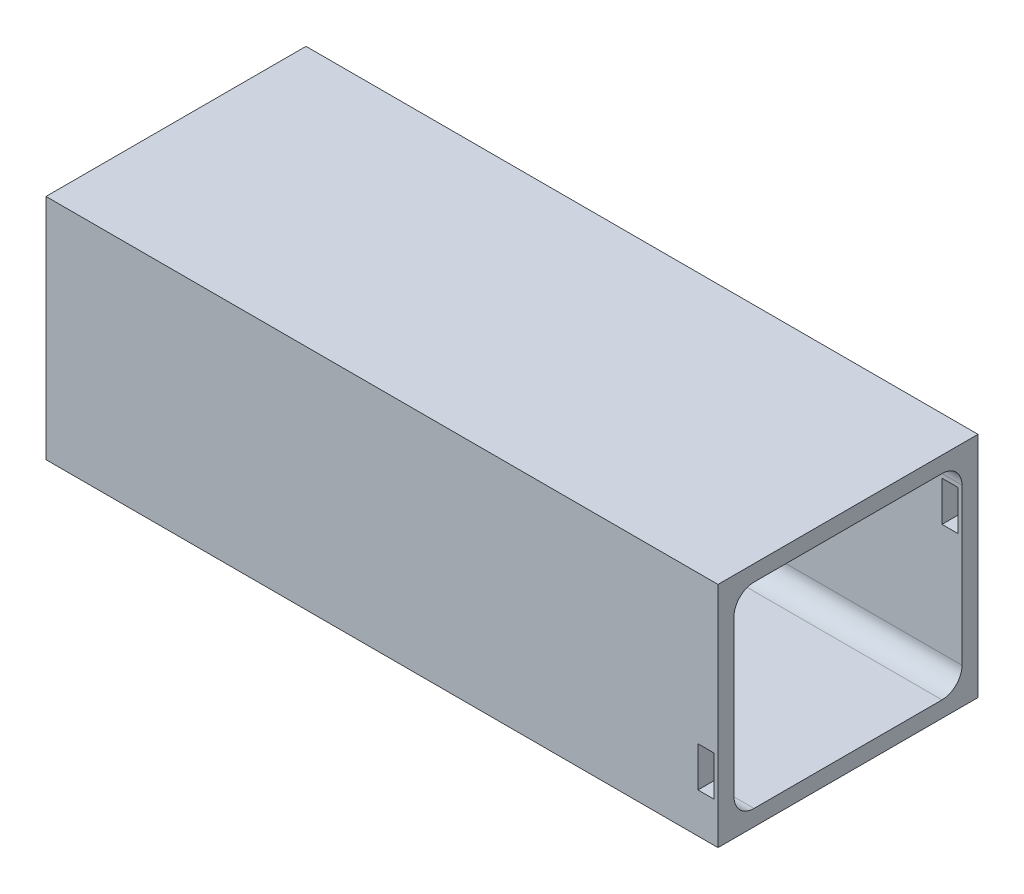
from build123d import *

# Parameters (mm, degrees)
SKETCH_1_W          = 65
SKETCH_1_H          = 57
EXTRUDE_1_DEPTH     = 167
SKETCH_2_W          = 4
SKETCH_2_H          = 10
CUT_EXTRUDE_1_DEPTH = 10
SKETCH_3_W          = 65
SKETCH_3_H          = 57
EXTRUDE_2_DEPTH     = 1
SKETCH_4_W          = 4
SKETCH_4_H          = 10
CUT_EXTRUDE_2_DEPTH = 10


with BuildPart() as part:
    # Эскиз1 → Бобышка-Вытянуть1 (new body)
    with BuildSketch(Plane(origin=(0, 0, 0), x_dir=(0, 0, -1), z_dir=(1, 0, 0))):
        Rectangle(SKETCH_1_W, SKETCH_1_H)
        with BuildLine():
            Line((23.5, -24.5), (-23.5, -24.5))
            ThreePointArc((-23.5, -24.5), (-27.035533906, -23.035533906), (-28.5, -19.5))
            Line((-28.5, -19.5), (-28.5, 19.5))
            ThreePointArc((-28.5, 19.5), (-27.035533906, 23.035533906), (-23.5, 24.5))
            Line((-23.5, 24.5), (23.5, 24.5))
            ThreePointArc((23.5, 24.5), (27.035533906, 23.035533906), (28.5, 19.5))
            Line((28.5, 19.5), (28.5, -19.5))
            ThreePointArc((28.5, -19.5), (27.035533906, -23.035533906), (23.5, -24.5))
        make_face(mode=Mode.SUBTRACT)
    extrude(amount=-EXTRUDE_1_DEPTH)

    # Эскиз2 → Вырез-Вытянуть1 (cut)
    with BuildSketch(Plane.XY.offset(32.5)):
        with Locations((-3, -13.5)):
            Rectangle(SKETCH_2_W, SKETCH_2_H)
    extrude(amount=-CUT_EXTRUDE_1_DEPTH, mode=Mode.SUBTRACT)

    # Эскиз3 → Бобышка-Вытянуть2 (add)
    with BuildSketch(Plane.ZY.offset(167)):
        Rectangle(SKETCH_3_W, SKETCH_3_H)
    extrude(amount=EXTRUDE_2_DEPTH)

    # Эскиз4 → Вырез-Вытянуть2 (cut)
    with BuildSketch(Plane(origin=(0, 0, -32.5), x_dir=(-1, 0, 0), z_dir=(0, 0, -1))):
        with Locations((3, 13.5)):
            Rectangle(SKETCH_4_W, SKETCH_4_H)
    extrude(amount=-CUT_EXTRUDE_2_DEPTH, mode=Mode.SUBTRACT)


solid = part.part
